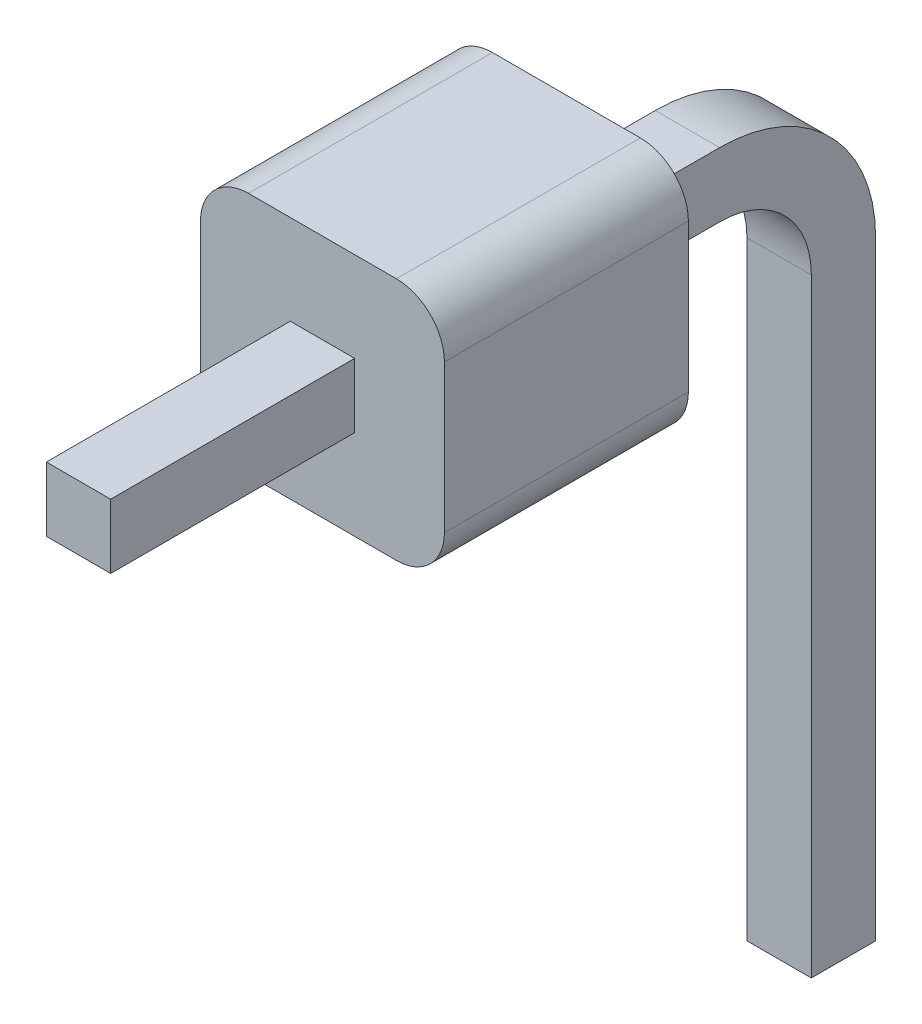
from build123d import *

# Parameters (mm, degrees)
SKETCH_1_W      = 2.54
SKETCH_1_H      = 2.54
EXTRUDE_1_DEPTH = 2.54
SKETCH_2_W      = 0.67
SKETCH_2_H      = 0.67
FILLET_1_R      = 0.5


with BuildPart() as part:
    # 草图1 → 拉伸1 (new body)
    with BuildSketch(Plane.XY):
        with Locations((0, -1.289090726)):
            Rectangle(SKETCH_1_W, SKETCH_1_H)
    extrude(amount=EXTRUDE_1_DEPTH)

    # 扫描1: sweep along a path in 草图3
    with BuildLine(Plane(origin=(0, 0, 0), x_dir=(0, 0, -1), z_dir=(1, 0, 0))) as sweep_1_path:
        Line((-5.08, -1.299090726), (1.26, -1.299090726))
        ThreePointArc((1.26, -1.299090726), (2.16509668, -1.673994046), (2.54, -2.579090726))
        Line((2.54, -2.579090726), (2.54, -8.919090726))
    # 草图2 → 扫描1 (sweep)
    with BuildSketch(Plane(origin=(0, 0, 5.08), x_dir=(-1, 0, 0), z_dir=(0, 0, -1))):
        with Locations((0, -1.289090726)):
            Rectangle(SKETCH_2_W, SKETCH_2_H)
    sweep(path=sweep_1_path.line)

    # 圆角1
    fillet_1_edges = [part.edges().sort_by_distance(p)[0] for p in [
        (-1.27, -0.019090726, 1.27),
        (1.27, -0.019090726, 1.27),
        (1.27, -2.559090726, 1.27),
        (-1.27, -2.559090726, 1.27),
    ]]
    fillet(fillet_1_edges, radius=FILLET_1_R)


solid = part.part
